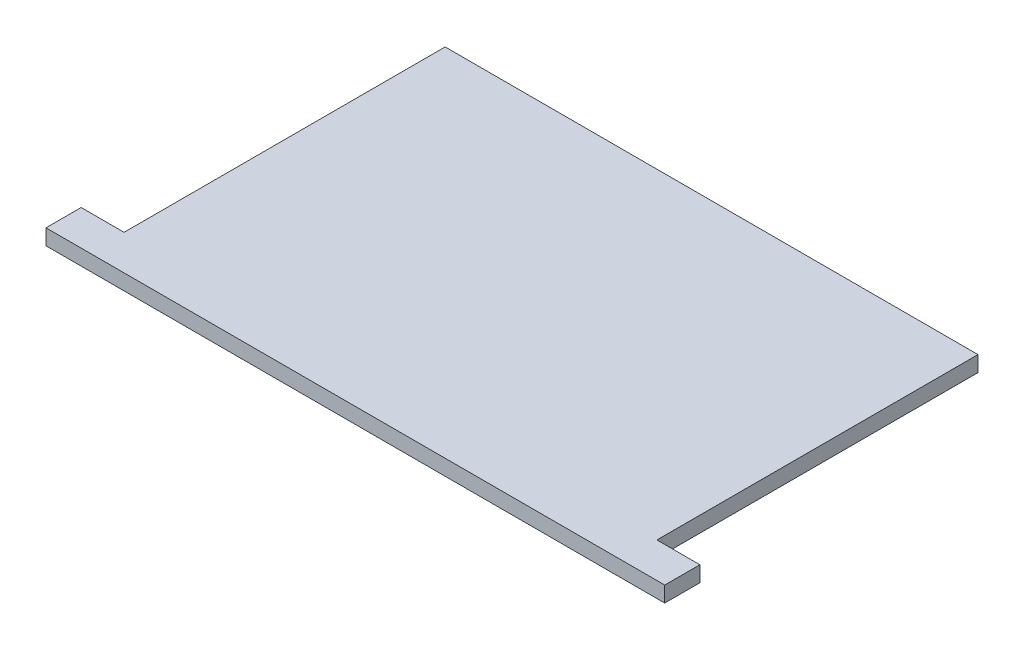
from build123d import *

# Parameters (mm, degrees)
SKETCH1_W           = 317
SKETCH1_H           = 182.5
BOSS_EXTRUDE1_DEPTH = 8
SKETCH3_W           = 22
SKETCH3_H           = 164.5
CUT_EXTRUDE3_DEPTH  = 184.065049914
SKETCH4_W           = 273
SKETCH4_H           = 164.5
CUT_EXTRUDE4_DEPTH  = 6
SKETCH5_W           = 20
SKETCH5_H           = 164.5
BOSS_EXTRUDE3_DEPTH = 6


with BuildPart() as part:
    # Sketch1 → Boss-Extrude1 (new body)
    with BuildSketch(Plane(origin=(0, 0, 0), x_dir=(1, 0, 0), z_dir=(0, 1, 0))):
        Rectangle(SKETCH1_W, SKETCH1_H)
    extrude(amount=BOSS_EXTRUDE1_DEPTH)

    # Sketch3 → Cut-Extrude3 (cut, through all)
    with BuildSketch(Plane(origin=(0, 8, 0), x_dir=(1, 0, 0), z_dir=(0, 1, 0))):
        with Locations((-147.5, 9)):
            Rectangle(SKETCH3_W, SKETCH3_H)
        with Locations((147.5, 9)):
            Rectangle(SKETCH3_W, SKETCH3_H)
    extrude(amount=-CUT_EXTRUDE3_DEPTH, mode=Mode.SUBTRACT)

    # Sketch4 → Cut-Extrude4 (cut)
    with BuildSketch(Plane.XZ):
        with Locations((0, -9)):
            Rectangle(SKETCH4_W, SKETCH4_H)
    extrude(amount=-CUT_EXTRUDE4_DEPTH, mode=Mode.SUBTRACT)

    # Sketch5 → Boss-Extrude3 (add)
    with BuildSketch(Plane.XZ.offset(-6)):
        with Locations((-126.5, -9)):
            Rectangle(SKETCH5_W, SKETCH5_H)
        with Locations((126.5, -9)):
            Rectangle(SKETCH5_W, SKETCH5_H)
    extrude(amount=BOSS_EXTRUDE3_DEPTH)


solid = part.part
